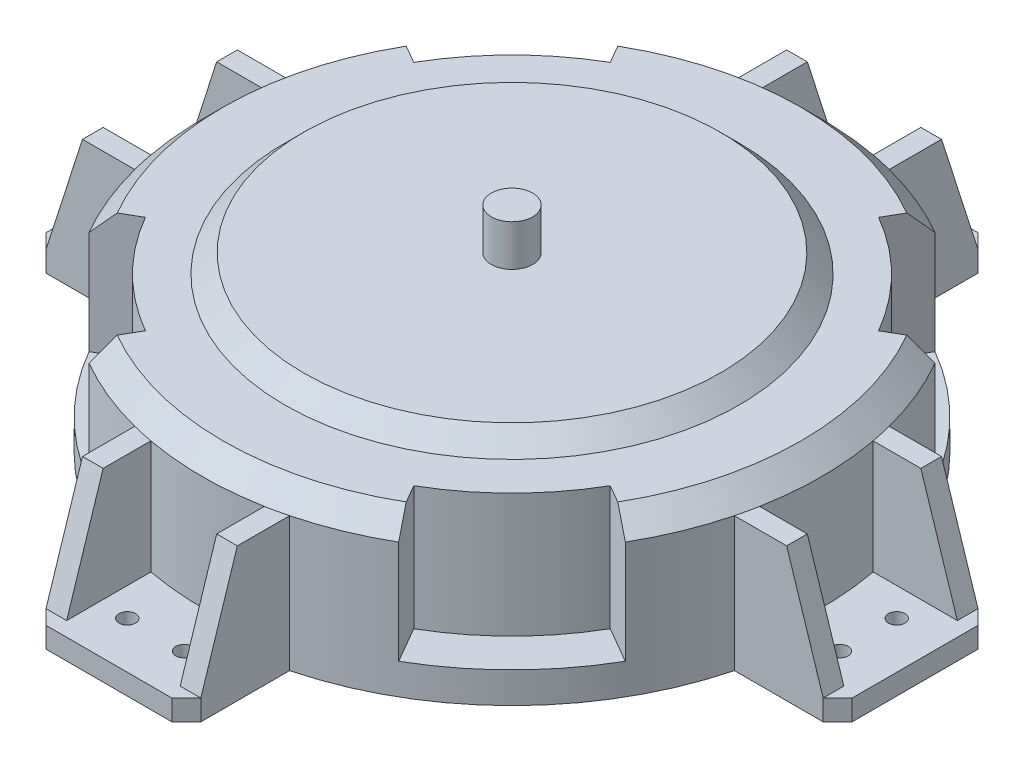
from build123d import *

# Parameters (mm, degrees)
SKETCH1_R                    = 150
BOSS_EXTRUDE1_DEPTH          = 75
CHAMFER1_SIZE                = 10
BOSS_EXTRUDE3_START          = -75
BOSS_EXTRUDE3_DEPTH          = 10
CHAMFER2_SIZE                = 7
BOSS_EXTRUDE4_DEPTH          = 10
SKETCH4_R                    = 4
CUT_EXTRUDE1_DEPTH           = 258.376062501
CIRPATTERN1_COUNT            = 4
CIRPATTERN1_COPY_1_DEPTH     = 10
CIRPATTERN1_COPY_2_DEPTH     = 10
CIRPATTERN1_COPY_3_DEPTH     = 10
CIRPATTERN1_COPY_4_SKETCH_R  = 4
CIRPATTERN1_COPY_4_DEPTH     = 258.376062501
CIRPATTERN1_COPY_5_SKETCH_R  = 4
CIRPATTERN1_COPY_5_DEPTH     = 258.376062501
CIRPATTERN1_COPY_6_SKETCH_R  = 4
CIRPATTERN1_COPY_6_DEPTH     = 258.376062501
CHAMFER2_OF_CIRPATTERN1_SIZE = 7
CUT_EXTRUDE2_START           = -60
CUT_EXTRUDE2_DEPTH           = 60
CIRPATTERN2_COUNT            = 4
SKETCH7_R                    = 110
BOSS_EXTRUDE5_DEPTH          = 9
BOSS_EXTRUDE5_TAPER          = 45
SKETCH8_R                    = 10
BOSS_EXTRUDE6_DEPTH          = 20


with BuildPart() as part:
    # Sketch1 → Boss-Extrude1 (new body)
    with BuildSketch(Plane(origin=(0, 0, 0), x_dir=(1, 0, 0), z_dir=(0, 1, 0))):
        with Locations(Location((0, 0, 0), (0, 0, 270))):
            Circle(SKETCH1_R)
    extrude(amount=BOSS_EXTRUDE1_DEPTH)

    # Chamfer1
    chamfer1_edges = [part.edges().sort_by_distance(p)[0] for p in [
        (0, 75, -150),
    ]]
    chamfer(chamfer1_edges, length=CHAMFER1_SIZE)

    # Sketch2 → Boss-Extrude3 (add)
    with BuildSketch(Plane(origin=(0, 75, 0), x_dir=(1, 0, 0), z_dir=(0, 1, 0)).offset(BOSS_EXTRUDE3_START)):
        with BuildLine():
            Line((-195.236875483, 37.5), (-195.236875483, -37.5))
            Line((-195.236875483, -37.5), (-145.236875483, -37.5))
            ThreePointArc((-145.236875483, -37.5), (-150, 0), (-145.236875483, 37.5))
            Line((-145.236875483, 37.5), (-195.236875483, 37.5))
        make_face()
    boss_extrude3 = extrude(amount=BOSS_EXTRUDE3_DEPTH)

    # Chamfer2
    chamfer2_edges = [part.edges().sort_by_distance(p)[0] for p in [
        (-195.236875483, 5, -37.5),
        (-195.236875483, 5, 37.5),
    ]]
    chamfer(chamfer2_edges, length=CHAMFER2_SIZE)

    # Sketch3 → Boss-Extrude4 (add)
    with BuildSketch(Plane.XY.offset(37.5)):
        Polygon((-144.19716267, 65), (-170.556875483, 65), (-188.236875483, 10), (-188.236875483, 0), (-145.236875483, 0), align=None)
    boss_extrude4 = extrude(amount=-BOSS_EXTRUDE4_DEPTH)

    # Sketch4 → Cut-Extrude1 (cut, through all)
    with BuildSketch(Plane(origin=(0, 75, 0), x_dir=(1, 0, 0), z_dir=(0, 1, 0))):
        with Locations(Location((-172.618437741, -13.75, 0), (0, 0, 270))):
            Circle(SKETCH4_R)
    cut_extrude1 = extrude(amount=-CUT_EXTRUDE1_DEPTH, mode=Mode.SUBTRACT)

    # Mirror3: Boss-Extrude4, Cut-Extrude1 across plane
    add(boss_extrude4.mirror(Plane.XY))
    add(cut_extrude1.mirror(Plane.XY), mode=Mode.SUBTRACT)

    # CirPattern1: Boss-Extrude3, Boss-Extrude4, Cut-Extrude1 ×4 about axis
    cirpattern1_axis = Axis((0, 0, 0), (0, 1, 0))
    add([boss_extrude3.rotate(cirpattern1_axis, i * 360 / CIRPATTERN1_COUNT) for i in range(1, CIRPATTERN1_COUNT)])
    add([boss_extrude4.rotate(cirpattern1_axis, i * 360 / CIRPATTERN1_COUNT) for i in range(1, CIRPATTERN1_COUNT)])
    add([cut_extrude1.rotate(cirpattern1_axis, i * 360 / CIRPATTERN1_COUNT) for i in range(1, CIRPATTERN1_COUNT)], mode=Mode.SUBTRACT)

    # CirPattern1 copy 1 sketch → CirPattern1 copy 1 (add)
    with BuildSketch(Plane(origin=(-37.5, 0, 0), x_dir=(0, 0, -1), z_dir=(-1, 0, 0))):
        Polygon((-144.19716267, -65), (-170.556875483, -65), (-188.236875483, -10), (-188.236875483, 0), (-145.236875483, 0), align=None)
    extrude(amount=-CIRPATTERN1_COPY_1_DEPTH)

    # CirPattern1 copy 2 sketch → CirPattern1 copy 2 (add)
    with BuildSketch(Plane(origin=(0, 0, 37.5), x_dir=(-1, 0, 0), z_dir=(0, 0, 1))):
        Polygon((-144.19716267, -65), (-170.556875483, -65), (-188.236875483, -10), (-188.236875483, 0), (-145.236875483, 0), align=None)
    extrude(amount=-CIRPATTERN1_COPY_2_DEPTH)

    # CirPattern1 copy 3 sketch → CirPattern1 copy 3 (add)
    with BuildSketch(Plane(origin=(37.5, 0, 0), x_dir=(0, 0, 1), z_dir=(1, 0, 0))):
        Polygon((-144.19716267, -65), (-170.556875483, -65), (-188.236875483, -10), (-188.236875483, 0), (-145.236875483, 0), align=None)
    extrude(amount=-CIRPATTERN1_COPY_3_DEPTH)

    # CirPattern1 copy 4 sketch → CirPattern1 copy 4 (cut, through all)
    with BuildSketch(Plane(origin=(0, 75, 0), x_dir=(0, 0, -1), z_dir=(0, 1, 0))):
        with Locations((-172.618437741, 13.75)):
            Circle(CIRPATTERN1_COPY_4_SKETCH_R)
    extrude(amount=-CIRPATTERN1_COPY_4_DEPTH, mode=Mode.SUBTRACT)

    # CirPattern1 copy 5 sketch → CirPattern1 copy 5 (cut, through all)
    with BuildSketch(Plane(origin=(0, 75, 0), x_dir=(-1, 0, 0), z_dir=(0, 1, 0))):
        with Locations((-172.618437741, 13.75)):
            Circle(CIRPATTERN1_COPY_5_SKETCH_R)
    extrude(amount=-CIRPATTERN1_COPY_5_DEPTH, mode=Mode.SUBTRACT)

    # CirPattern1 copy 6 sketch → CirPattern1 copy 6 (cut, through all)
    with BuildSketch(Plane.ZX.offset(75)):
        with Locations((-172.618437741, 13.75)):
            Circle(CIRPATTERN1_COPY_6_SKETCH_R)
    extrude(amount=-CIRPATTERN1_COPY_6_DEPTH, mode=Mode.SUBTRACT)

    # Chamfer2 of CirPattern1
    chamfer2_of_cirpattern1_edges = [part.edges().sort_by_distance(p)[0] for p in [
        (-37.5, 5, 195.236875483),
        (37.5, 5, 195.236875483),
        (195.236875483, 5, 37.5),
        (195.236875483, 5, -37.5),
        (37.5, 5, -195.236875483),
        (-37.5, 5, -195.236875483),
    ]]
    chamfer(chamfer2_of_cirpattern1_edges, length=CHAMFER2_OF_CIRPATTERN1_SIZE)

    # Sketch6 → Cut-Extrude2 (cut)
    with BuildSketch(Plane(origin=(0, 75, 0), x_dir=(1, 0, 0), z_dir=(0, 1, 0)).offset(CUT_EXTRUDE2_START)):
        with BuildLine():
            Line((-112.583302492, -65), (-129.903810568, -75))
            ThreePointArc((-129.903810568, -75), (-106.066017178, -106.066017178), (-75, -129.903810568))
            Line((-75, -129.903810568), (-65, -112.583302492))
            ThreePointArc((-65, -112.583302492), (-91.923881554, -91.923881554), (-112.583302492, -65))
        make_face()
    cut_extrude2 = extrude(amount=CUT_EXTRUDE2_DEPTH, mode=Mode.SUBTRACT)

    # CirPattern2: Cut-Extrude2 ×4 about axis
    cirpattern2_axis = Axis((0, 75, 0), (0, 1, 0))
    for i in range(1, CIRPATTERN2_COUNT):
        add(cut_extrude2.rotate(cirpattern2_axis, i * 360 / CIRPATTERN2_COUNT), mode=Mode.SUBTRACT)

    # Sketch7 → Boss-Extrude5 (add)
    with BuildSketch(Plane(origin=(0, 75, 0), x_dir=(1, 0, 0), z_dir=(0, 1, 0))):
        Circle(SKETCH7_R)
    extrude(amount=BOSS_EXTRUDE5_DEPTH, taper=BOSS_EXTRUDE5_TAPER)

    # Sketch8 → Boss-Extrude6 (add)
    with BuildSketch(Plane(origin=(0, 84, 0), x_dir=(1, 0, 0), z_dir=(0, 1, 0))):
        with Locations(Location((0, 0, 0), (0, 0, 270))):
            Circle(SKETCH8_R)
    extrude(amount=BOSS_EXTRUDE6_DEPTH)


solid = part.part
